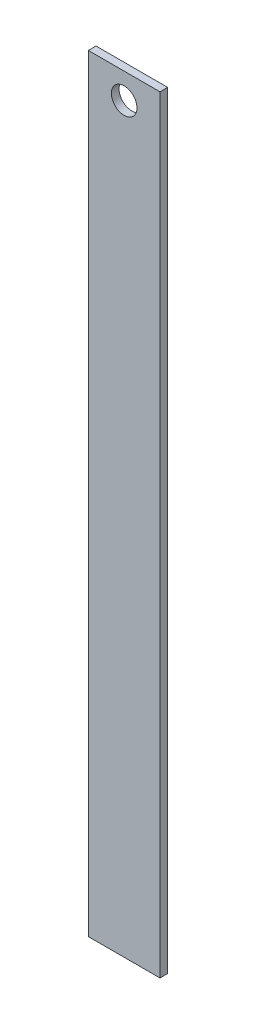
from build123d import *

# Parameters (mm, degrees)
CROQUIS1_W              = 28
CROQUIS1_H              = 300
SALIENTE_EXTRUIR1_DEPTH = 3
CROQUIS2_R              = 5
CORTAR_EXTRUIR1_DEPTH   = 151.681783902


with BuildPart() as part:
    # Croquis1 → Saliente-Extruir1 (new body)
    with BuildSketch(Plane.XY):
        Rectangle(CROQUIS1_W, CROQUIS1_H)
    extrude(amount=SALIENTE_EXTRUIR1_DEPTH)

    # Croquis2 → Cortar-Extruir1 (cut, through all)
    with BuildSketch(Plane(origin=(0, 0, 0), x_dir=(-1, 0, 0), z_dir=(0, 0, -1))):
        with Locations((0, 140)):
            Circle(CROQUIS2_R)
    extrude(amount=-CORTAR_EXTRUIR1_DEPTH, mode=Mode.SUBTRACT)


solid = part.part
